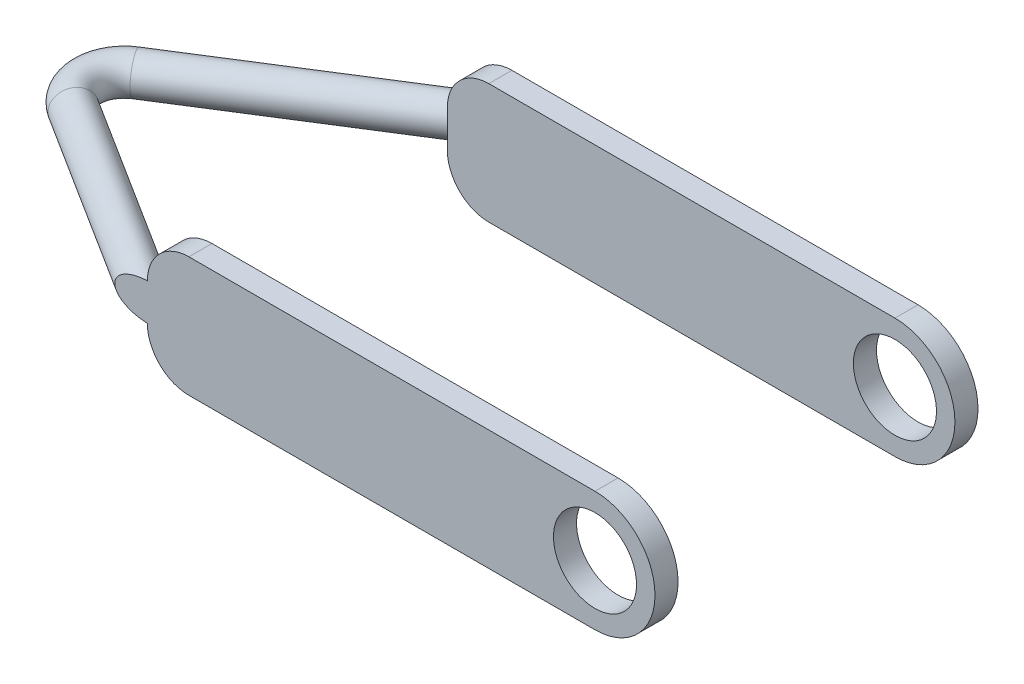
from build123d import *

# Parameters (mm, degrees)
SKETCH2_R           = 4
CUT_EXTRUDE1_DEPTH  = 10
SKETCH5_W           = 110
SKETCH5_H           = 5
BOSS_EXTRUDE1_DEPTH = 13
SKETCH6_R           = 9
CUT_EXTRUDE2_DEPTH  = 13
CUT_EXTRUDE3_DEPTH  = 10


with BuildPart() as part:
    # Sweep1: sweep along a path in Sketch1
    with BuildLine(Plane(origin=(0, 0, 0), x_dir=(1, 0, 0), z_dir=(0, 1, 0))) as sweep1_path:
        Line((52.389202821, -40.03089611), (-0.272615345, -6.763487127))
        ThreePointArc((-0.272615345, -6.763487127), (-3.006458548, -3.861287171), (-4, 0))
    # Sketch2 → Sweep1 (sweep)
    with BuildSketch(Plane.XY):
        with Locations((-4, 0)):
            Circle(SKETCH2_R)
    sweep1 = sweep(path=sweep1_path.line)

    # Sketch4 → Cut-Extrude1 (cut, symmetric)
    with BuildSketch(Plane(origin=(0, 0, 0), x_dir=(1, 0, 0), z_dir=(0, 1, 0))):
        Polygon((44, -35), (34.597308022, -35), (44, -46.531698577), (57.177061071, -46.531698577), (57.177061071, -30), (44, -30), align=None)
    cut_extrude1 = extrude(amount=CUT_EXTRUDE1_DEPTH, both=True, mode=Mode.SUBTRACT)

    # Sketch5 → Boss-Extrude1 (add, symmetric)
    with BuildSketch(Plane(origin=(0, 0, 0), x_dir=(1, 0, 0), z_dir=(0, 1, 0))):
        with Locations((99, -32.5)):
            Rectangle(SKETCH5_W, SKETCH5_H)
    boss_extrude1 = extrude(amount=BOSS_EXTRUDE1_DEPTH, both=True)

    # Sketch6 → Cut-Extrude2 (cut, symmetric)
    with BuildSketch(Plane.XY.offset(35)):
        with Locations((141, 0)):
            Circle(SKETCH6_R)
        with BuildLine():
            Line((53, 13), (52.778372403, 14.264161609))
            Line((52.778372403, 14.264161609), (42.606717514, 14.264161609))
            Line((42.606717514, 14.264161609), (42.848324519, 6.72602307))
            Line((42.848324519, 6.72602307), (44, 4))
            ThreePointArc((44, 4), (46.636038969, 10.363961031), (53, 13))
        make_face()
    cut_extrude2 = extrude(amount=CUT_EXTRUDE2_DEPTH, both=True, mode=Mode.SUBTRACT)

    # Sketch7 → Cut-Extrude3 (cut)
    with BuildSketch(Plane.XY.offset(35)):
        with BuildLine():
            Line((44, -13), (53, -13))
            ThreePointArc((53, -13), (46.636038969, -10.363961031), (44, -4))
            Line((44, -4), (44, -13))
        make_face()
        with BuildLine():
            ThreePointArc((154, 1.44e-07), (150.192388206, -9.192388104), (141, -13))
            Line((141, -13), (154, -13))
            Line((154, -13), (154, 1.44e-07))
        make_face()
        with BuildLine():
            ThreePointArc((141, 13), (150.192388104, 9.192388206), (154, 1.44e-07))
            Line((154, 1.44e-07), (154, 13))
            Line((154, 13), (141, 13))
        make_face()
    cut_extrude3 = extrude(amount=-CUT_EXTRUDE3_DEPTH, mode=Mode.SUBTRACT)

    # Mirror1: Sweep1, Cut-Extrude1, Boss-Extrude1, Cut-Extrude2, Cut-Extrude3 across plane
    add(sweep1.mirror(Plane(origin=(-4, 0, 0), x_dir=(1, 0, 0), z_dir=(0, 0, 1))))
    add(cut_extrude1.mirror(Plane(origin=(-4, 0, 0), x_dir=(1, 0, 0), z_dir=(0, 0, 1))), mode=Mode.SUBTRACT)
    add(boss_extrude1.mirror(Plane(origin=(-4, 0, 0), x_dir=(1, 0, 0), z_dir=(0, 0, 1))))
    add(cut_extrude2.mirror(Plane(origin=(-4, 0, 0), x_dir=(1, 0, 0), z_dir=(0, 0, 1))), mode=Mode.SUBTRACT)
    add(cut_extrude3.mirror(Plane(origin=(-4, 0, 0), x_dir=(1, 0, 0), z_dir=(0, 0, 1))), mode=Mode.SUBTRACT)


solid = part.part
